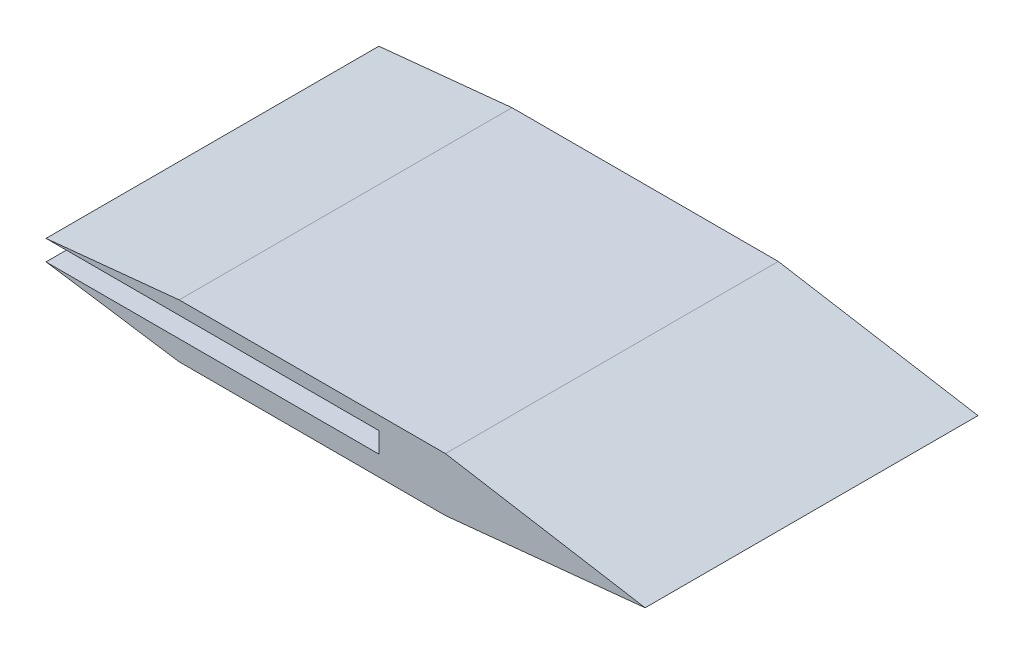
from build123d import *

# Parameters (mm, degrees)
P_IDAT_VYSUNUT_M1_DEPTH = 50


with BuildPart() as part:
    # Skica1 → Přidat vysunutím1 (new body)
    with BuildSketch(Plane.XY):
        Polygon((0, 0), (20, 2), (60, 2), (90, -3.06), (60, -6.06), (20, -6.06), (0, -3.06), (50, -3.06), (50, 0), align=None)
    extrude(amount=P_IDAT_VYSUNUT_M1_DEPTH)


solid = part.part
